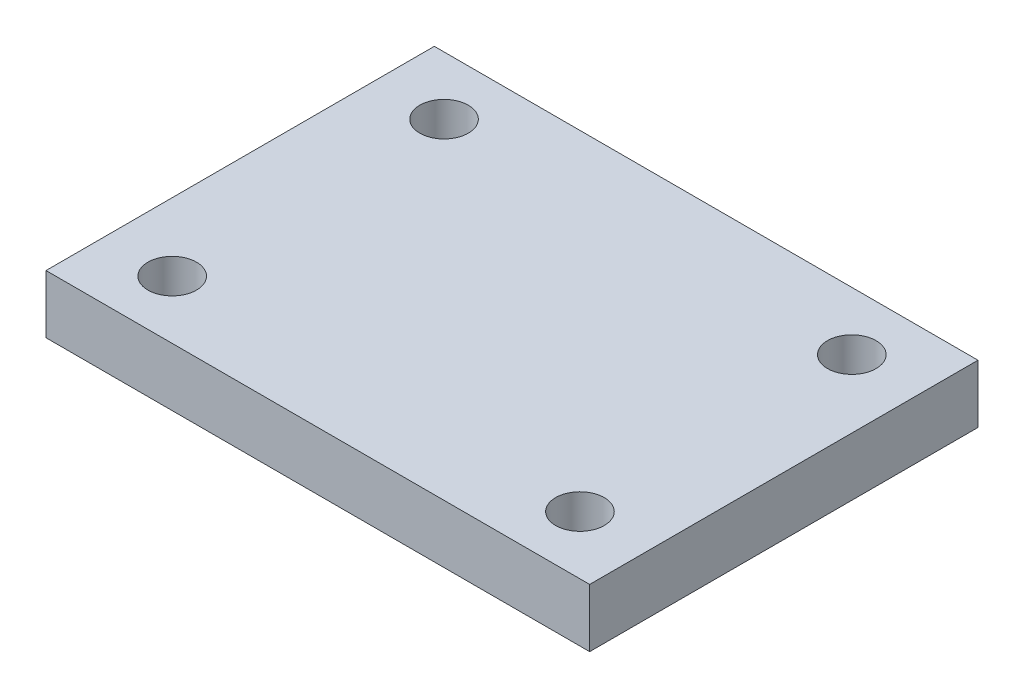
from build123d import *

# Parameters (mm, degrees)
SKETCH1_W           = 28
SKETCH1_H           = 20
BOSS_EXTRUDE1_DEPTH = 3
M3_TAPPED_HOLE1_D   = 2.5


with BuildPart() as part:
    # Sketch1 → Boss-Extrude1 (new body)
    with BuildSketch(Plane(origin=(0, 0, 0), x_dir=(1, 0, 0), z_dir=(0, 1, 0))):
        Rectangle(SKETCH1_W, SKETCH1_H)
    extrude(amount=BOSS_EXTRUDE1_DEPTH)

    # M3 Tapped Hole1 (through all)
    with Locations(Plane(origin=(0, 3, 0), x_dir=(1, 0, 0), z_dir=(0, 1, 0))):
        with Locations((-10.5, 7), (-10.5, -7), (10.5, -7), (10.5, 7)):
            Hole(M3_TAPPED_HOLE1_D / 2)


solid = part.part
